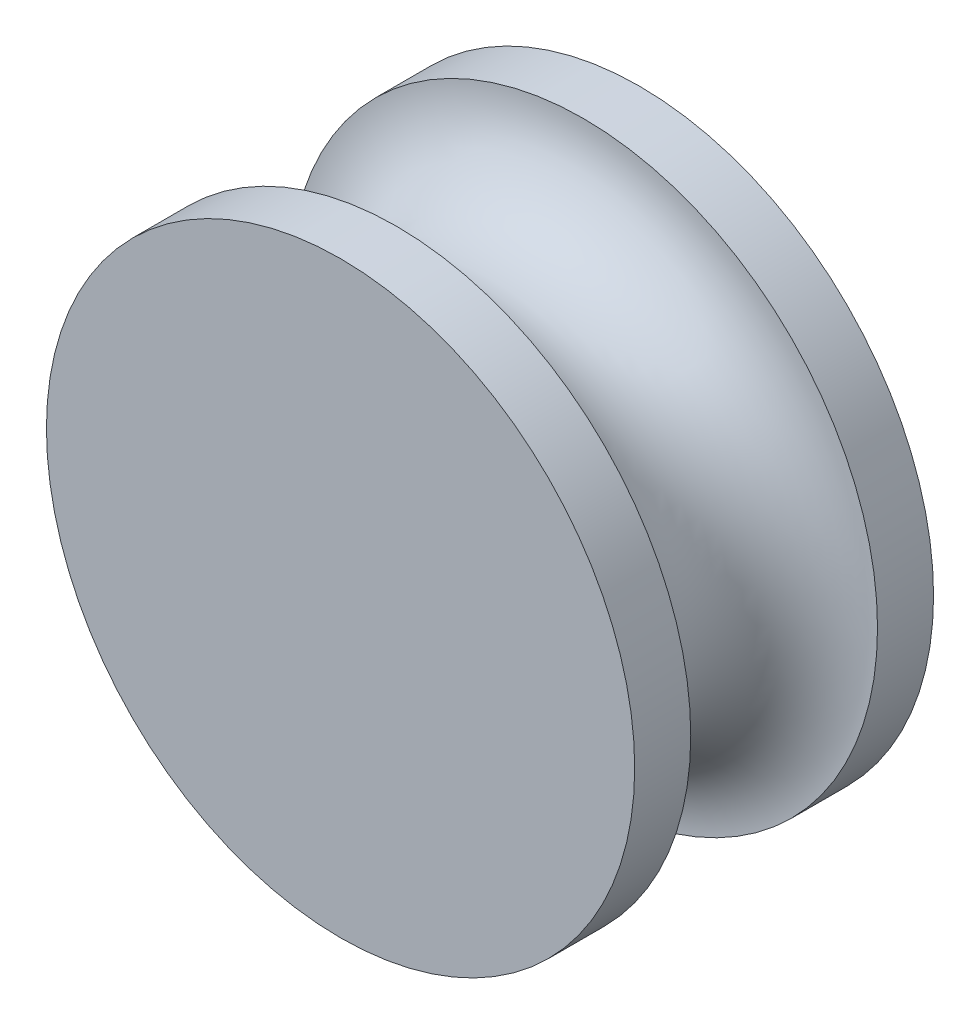
from build123d import *

# Parameters (mm, degrees)
SKETCH1_R           = 25
BOSS_EXTRUDE1_DEPTH = 12.7


with BuildPart() as part:
    # Sketch1 → Boss-Extrude1 (new, symmetric)
    with BuildSketch(Plane.XY):
        Circle(SKETCH1_R)
    extrude(amount=BOSS_EXTRUDE1_DEPTH, both=True)

    # Sketch2 → Cut-Revolve1 (revolve, cut)
    with BuildSketch(Plane(origin=(0, 0, 0), x_dir=(1, 0, 0), z_dir=(0, 1, 0)), mode=Mode.PRIVATE) as cut_revolve1_sk:
        with BuildLine():
            ThreePointArc((-25, 7.9375), (-17.0625, 0), (-25, -7.9375))
            Line((-25, -7.9375), (-25, 7.9375))
        make_face()
    revolve(cut_revolve1_sk.sketch.rotate(Axis((0, 0, 12.7), (0, 0, -1)), 180), axis=Axis((0, 0, 12.7), (0, 0, -1)), mode=Mode.SUBTRACT)


solid = part.part
